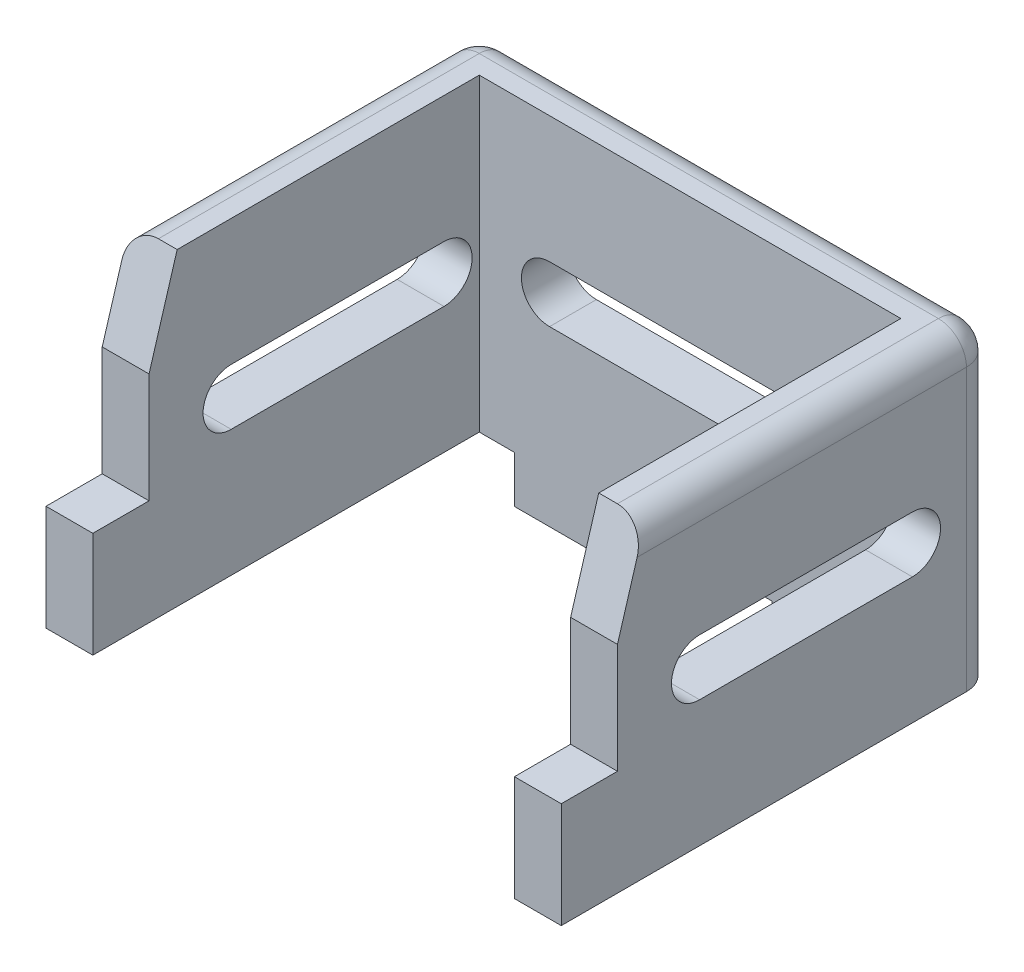
from build123d import *
from OCP.BRepFilletAPI import BRepFilletAPI_MakeChamfer

# Parameters (mm, degrees)
BOSS_EXTRUDE1_DEPTH     = 5
BOSS_EXTRUDE1_2_DEPTH   = 5
BOSS_EXTRUDE2_DEPTH     = 33
CUT_EXTRUDE1_DEPTH      = 75.424878233
CUT_EXTRUDE1_DEPTH_BACK = 75.424878233
SKETCH4_W               = 5
SKETCH4_H               = 11.27
BOSS_EXTRUDE3_DEPTH     = 6
CHAMFER1_SIZE           = 10
CHAMFER1_SIZE2          = 3
CUT_EXTRUDE2_DEPTH      = 60.555121526
FILLET1_R               = 3
FILLET2_R               = 3


with BuildPart() as part:
    # Sketch1 → Boss-Extrude1 (new body)
    with BuildSketch(Plane(origin=(0, 0, 0), x_dir=(1, 0, 0), z_dir=(0, 1, 0))):
        Polygon((-18.75, -2.5), (-17.25, 2.5), (-10.25, 2.5), (-8.75, -2.5), align=None)
    extrude(amount=-BOSS_EXTRUDE1_DEPTH)



with BuildPart() as body_2:
    # Sketch1 → Boss-Extrude1 2 (new body)
    with BuildSketch(Plane(origin=(0, 0, 0), x_dir=(1, 0, 0), z_dir=(0, 1, 0))):
        Polygon((17.25, 2.5), (10.25, 2.5), (8.75, -2.5), (18.75, -2.5), align=None)
    extrude(amount=-BOSS_EXTRUDE1_2_DEPTH)


with BuildPart() as part_1:
    add(part.part)

    add(body_2.part)  # Boss-Extrude2 merges body 2
    # Sketch2 → Boss-Extrude2 (add)
    with BuildSketch(Plane(origin=(0, 0, 0), x_dir=(1, 0, 0), z_dir=(0, 1, 0))):
        Polygon((27.5, 2.5), (-27.5, 2.5), (-27.5, -2.5), (-27.5, -37.75), (-22.5, -37.75), (-22.5, -2.5), (22.5, -2.5), (22.5, -37.75), (27.5, -37.75), (27.5, -2.5), align=None)
    extrude(amount=BOSS_EXTRUDE2_DEPTH)

    # Sketch3 → Cut-Extrude1 (cut, two sides: drawn at the far end of the back side and taken through both)
    with BuildSketch(Plane.ZY.offset(27.5).offset(-CUT_EXTRUDE1_DEPTH_BACK)):
        with BuildLine():
            Line((6.265950561, 19.5), (28.984049439, 19.5))
            ThreePointArc((28.984049439, 19.5), (31.984049439, 16.5), (28.984049439, 13.5))
            Line((28.984049439, 13.5), (6.265950561, 13.5))
            ThreePointArc((6.265950561, 13.5), (3.265950561, 16.5), (6.265950561, 19.5))
        make_face()
    extrude(amount=CUT_EXTRUDE1_DEPTH + CUT_EXTRUDE1_DEPTH_BACK, mode=Mode.SUBTRACT)

    # Sketch4 → Boss-Extrude3 (add)
    with BuildSketch(Plane.XY.offset(37.75)):
        with Locations((25, 5.635)):
            Rectangle(SKETCH4_W, SKETCH4_H)
        with Locations((-25, 5.635)):
            Rectangle(SKETCH4_W, SKETCH4_H)
    extrude(amount=BOSS_EXTRUDE3_DEPTH)

    # Chamfer1: one chamfer whose edges measure the first distance from different faces: ONE call of the kernel's chamfer builder (chamfer() names one face for all edges)
    chamfer1_edges_1 = [part_1.edges().sort_by_distance(p)[0] for p in [
        (-25, 33, 37.75),
    ]]
    chamfer1_side_1 = [part_1.faces().sort_by_distance(p)[0] for p in [
        (-25, 22.135, 37.75),
    ]]
    chamfer1_edges_2 = [part_1.edges().sort_by_distance(p)[0] for p in [
        (25, 33, 37.75),
    ]]
    chamfer1_side_2 = [part_1.faces().sort_by_distance(p)[0] for p in [
        (25, 22.135, 37.75),
    ]]
    chamfer1 = BRepFilletAPI_MakeChamfer(part_1.part.solid().wrapped)
    for e in chamfer1_edges_1:
        chamfer1.Add(CHAMFER1_SIZE, CHAMFER1_SIZE2, e.wrapped, chamfer1_side_1[0].wrapped)  # the first distance lies on this face
    for e in chamfer1_edges_2:
        chamfer1.Add(CHAMFER1_SIZE, CHAMFER1_SIZE2, e.wrapped, chamfer1_side_2[0].wrapped)  # the first distance lies on this face
    add(Compound.cast(chamfer1.Shape()), mode=Mode.REPLACE)

    # Sketch7 → Cut-Extrude2 (cut, through all)
    with BuildSketch(Plane.XY.offset(2.5)):
        with BuildLine():
            Line((-15, 19.5), (15, 19.5))
            ThreePointArc((15, 19.5), (18, 16.5), (15, 13.5))
            Line((15, 13.5), (-15, 13.5))
            ThreePointArc((-15, 13.5), (-18, 16.5), (-15, 19.5))
        make_face()
    extrude(amount=-CUT_EXTRUDE2_DEPTH, mode=Mode.SUBTRACT)

    # Fillet1
    fillet1_edges = [part_1.edges().sort_by_distance(p)[0] for p in [
        (27.5, 16.5, -2.5),
        (-27.5, 16.5, -2.5),
    ]]
    fillet(fillet1_edges, radius=FILLET1_R)

    # Fillet2
    fillet2_edges = [part_1.edges().sort_by_distance(p)[0] for p in [
        (27.5, 33, 17.625),
        (-27.5, 33, 17.625),
        (0, 33, -2.5),
        (26.621320344, 33, -1.621320344),
        (-26.621320344, 33, -1.621320344),
    ]]
    fillet(fillet2_edges, radius=FILLET2_R)


solid = part_1.part
